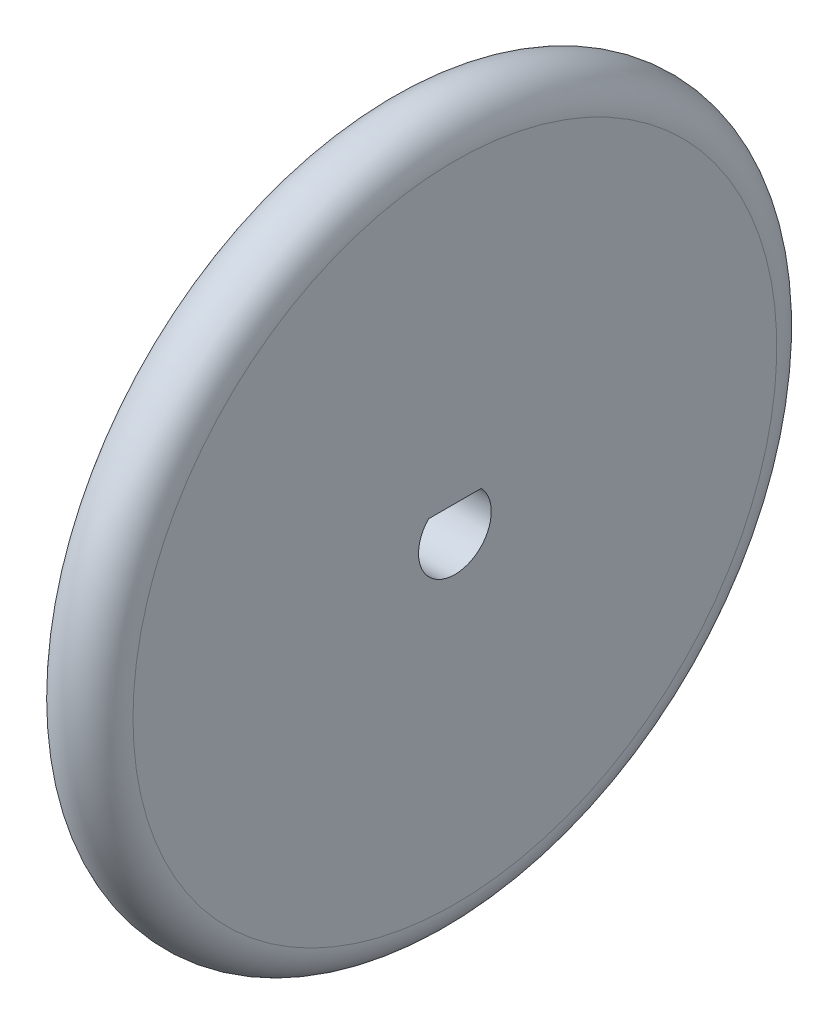
from build123d import *

# Parameters (mm, degrees)
SKETCH_3_R          = 4
EXTRUDE_1_DEPTH     = 3
CUT_EXTRUDE_1_DEPTH = 23.045407821


with BuildPart() as part:
    # ｽｹｯﾁ2 → 回転1 (revolve)
    with BuildSketch(Plane.XY, mode=Mode.PRIVATE) as revolve_1_sk:
        with BuildLine():
            Line((-1.5, 13.5), (-1.5, 0))
            Line((-1.5, 0), (1.5, 0))
            Line((1.5, 0), (1.5, 13.5))
            ThreePointArc((1.5, 13.5), (0, 15), (-1.5, 13.5))
        make_face()
    revolve(revolve_1_sk.sketch.rotate(Axis((0, 0, 0), (1, 0, 0)), 90), axis=Axis((0, 0, 0), (1, 0, 0)))

    # ｽｹｯﾁ3 → ﾎﾞｽ - 押し出し1 (add)
    with BuildSketch(Plane.ZY.offset(1.5)):
        with Locations(Location((0, 0, 0), (0, 0, 180))):
            Circle(SKETCH_3_R)
    extrude(amount=EXTRUDE_1_DEPTH)

    # ｽｹｯﾁ4 → ｶｯﾄ - 押し出し1 (cut, through all)
    with BuildSketch(Plane.ZY.offset(4.5)):
        with BuildLine():
            Line((-1.105949818, 1.05), (1.105949818, 1.05))
            ThreePointArc((1.105949818, 1.05), (0, -1.525), (-1.105949818, 1.05))
        make_face()
    extrude(amount=-CUT_EXTRUDE_1_DEPTH, mode=Mode.SUBTRACT)


solid = part.part
